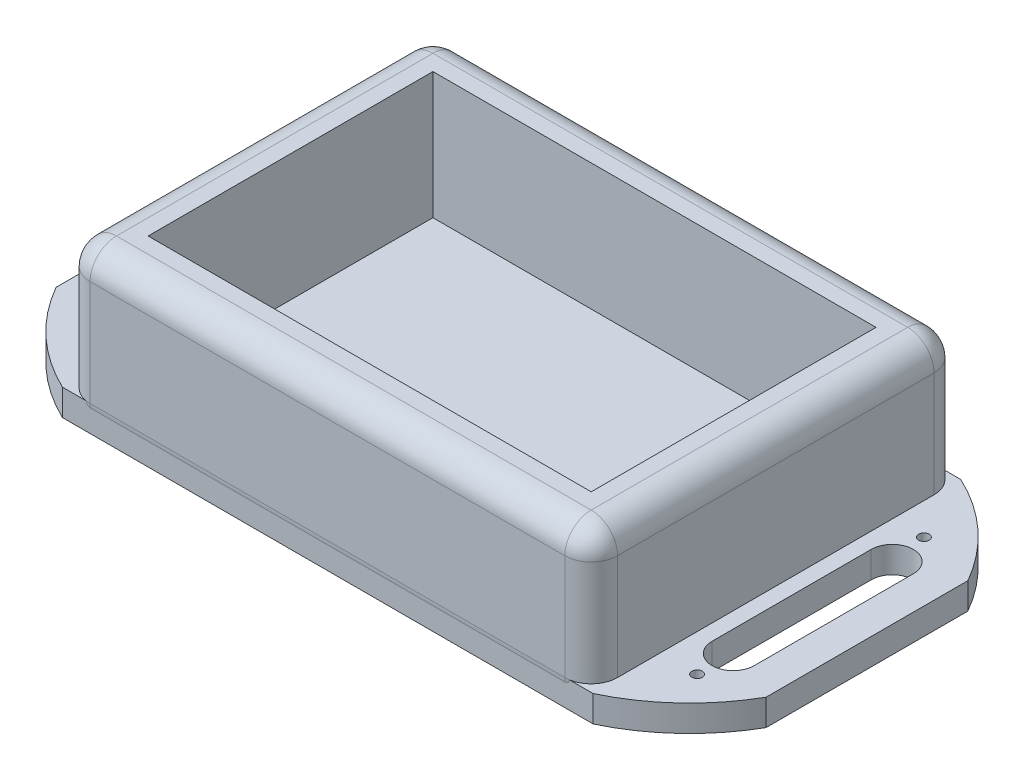
from build123d import *

# Parameters (mm, degrees)
BOSS_EXTRUDE2_DEPTH = 15
FILLET2_R           = 2.5
SKETCH3_R           = 0.5
BOSS_EXTRUDE4_DEPTH = 2.5
SKETCH4_W           = 42.002754972
SKETCH4_H           = 27.001036704
CUT_EXTRUDE1_DEPTH  = 12


with BuildPart() as part:
    # Sketch1 → Boss-Extrude2 (new body)
    with BuildSketch(Plane(origin=(0, 0, 0), x_dir=(1, 0, 0), z_dir=(0, 1, 0))):
        with BuildLine():
            Line((-23.383883476, 16.616116524), (21.616116524, 16.616116524))
            ThreePointArc((21.616116524, 16.616116524), (23.383883476, 15.883883476), (24.116116524, 14.116116524))
            Line((24.116116524, 14.116116524), (24.116116524, -15.883883476))
            ThreePointArc((24.116116524, -15.883883476), (23.383883476, -17.651650429), (21.616116524, -18.383883476))
            Line((21.616116524, -18.383883476), (-23.383883476, -18.383883476))
            ThreePointArc((-23.383883476, -18.383883476), (-25.151650429, -17.651650429), (-25.883883476, -15.883883476))
            Line((-25.883883476, -15.883883476), (-25.883883476, 14.116116524))
            ThreePointArc((-25.883883476, 14.116116524), (-25.151650429, 15.883883476), (-23.383883476, 16.616116524))
        make_face()
    extrude(amount=BOSS_EXTRUDE2_DEPTH)

    # Fillet2
    fillet2_edges = [part.edges().sort_by_distance(p)[0] for p in [
        (-25.151650429, 15, 17.651650429),
        (-25.883883476, 0, 0.883883476),
        (-25.151650429, 0, -15.883883476),
        (-0.883883476, 15, 18.383883476),
        (23.383883476, 15, 17.651650429),
        (24.116116524, 15, 0.883883476),
        (23.383883476, 15, -15.883883476),
        (-0.883883476, 15, -16.616116524),
        (-25.151650429, 15, -15.883883476),
        (-25.883883476, 15, 0.883883476),
        (-0.883883476, 0, -16.616116524),
        (23.383883476, 0, -15.883883476),
        (24.116116524, 0, 0.883883476),
        (23.383883476, 0, 17.651650429),
        (-0.883883476, 0, 18.383883476),
        (-25.151650429, 0, 17.651650429),
    ]]
    fillet(fillet2_edges, radius=FILLET2_R)

    # Sketch3 → Boss-Extrude4 (add)
    with BuildSketch(Plane(origin=(0, 0, 0), x_dir=(1, 0, 0), z_dir=(0, 1, 0))):
        with BuildLine():
            Line((-25.883883476, 16.646945133), (24.116116524, 16.646945133))
            ThreePointArc((24.116116524, 16.646945133), (29.061870418, 13.334132498), (32.766116524, 8.674328862))
            Line((32.766116524, 8.674328862), (32.766116524, -10.453501419))
            ThreePointArc((32.766116524, -10.453501419), (29.124788001, -15.055056138), (24.271254893, -18.353054867))
            Line((24.271254893, -18.353054867), (-26.039021846, -18.353054867))
            ThreePointArc((-26.039021846, -18.353054867), (-30.892554954, -15.055056138), (-34.533883476, -10.453501419))
            Line((-34.533883476, -10.453501419), (-34.533883476, 8.674328862))
            ThreePointArc((-34.533883476, 8.674328862), (-30.829637371, 13.334132498), (-25.883883476, 16.646945133))
        make_face()
        with Locations(Location((-28.883883476, 10.158483361, 0), (0, 0, 270))):
            Circle(SKETCH3_R, mode=Mode.SUBTRACT)
        with Locations(Location((-29.383883476, -11.841516639, 0), (0, 0, 270))):
            Circle(SKETCH3_R, mode=Mode.SUBTRACT)
        with Locations(Location((27.616116524, -11.841516639, 0), (0, 0, 270))):
            Circle(SKETCH3_R, mode=Mode.SUBTRACT)
        with Locations(Location((27.116116524, 10.158483361, 0), (0, 0, 270))):
            Circle(SKETCH3_R, mode=Mode.SUBTRACT)
        with BuildLine():
            Line((29.616116524, 6.658483361), (29.616116524, -8.426250314))
            ThreePointArc((29.616116524, -8.426250314), (27.616116524, -10.426250314), (25.616116524, -8.426250314))
            Line((25.616116524, -8.426250314), (25.616116524, 6.658483361))
            ThreePointArc((25.616116524, 6.658483361), (27.616116524, 8.658483361), (29.616116524, 6.658483361))
        make_face(mode=Mode.SUBTRACT)
        with BuildLine():
            Line((-31.383883476, 6.658483361), (-31.383883476, -8.426250314))
            ThreePointArc((-31.383883476, -8.426250314), (-29.383883476, -10.426250314), (-27.383883476, -8.426250314))
            Line((-27.383883476, -8.426250314), (-27.383883476, 6.658483361))
            ThreePointArc((-27.383883476, 6.658483361), (-29.383883476, 8.658483361), (-31.383883476, 6.658483361))
        make_face(mode=Mode.SUBTRACT)
    extrude(amount=BOSS_EXTRUDE4_DEPTH)

    # Sketch4 → Cut-Extrude1 (cut)
    with BuildSketch(Plane(origin=(0, 15, 0), x_dir=(1, 0, 0), z_dir=(0, 1, 0))):
        with Locations((-0.88269634, -0.884055652)):
            Rectangle(SKETCH4_W, SKETCH4_H)
    extrude(amount=-CUT_EXTRUDE1_DEPTH, mode=Mode.SUBTRACT)


solid = part.part
